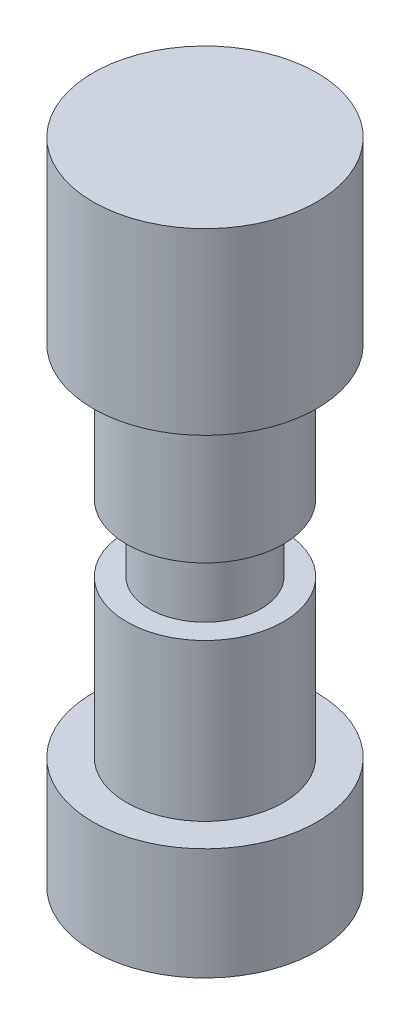
from build123d import *


with BuildPart() as part:
    # Croquis1 → Revolución1 (revolve)
    with BuildSketch(Plane.XY, mode=Mode.PRIVATE) as revoluci_n1_sk:
        Polygon((0, 0), (25, 0), (25, -40), (17.5, -40), (17.5, -70), (12.5, -70), (12.5, -85), (17.5, -85), (17.5, -120), (25, -120), (25, -145), (0, -145), align=None)
    revolve(revoluci_n1_sk.sketch.rotate(Axis((0, 0, 0), (0, 1, 0)), 90), axis=Axis((0, 0, 0), (0, 1, 0)))


solid = part.part
